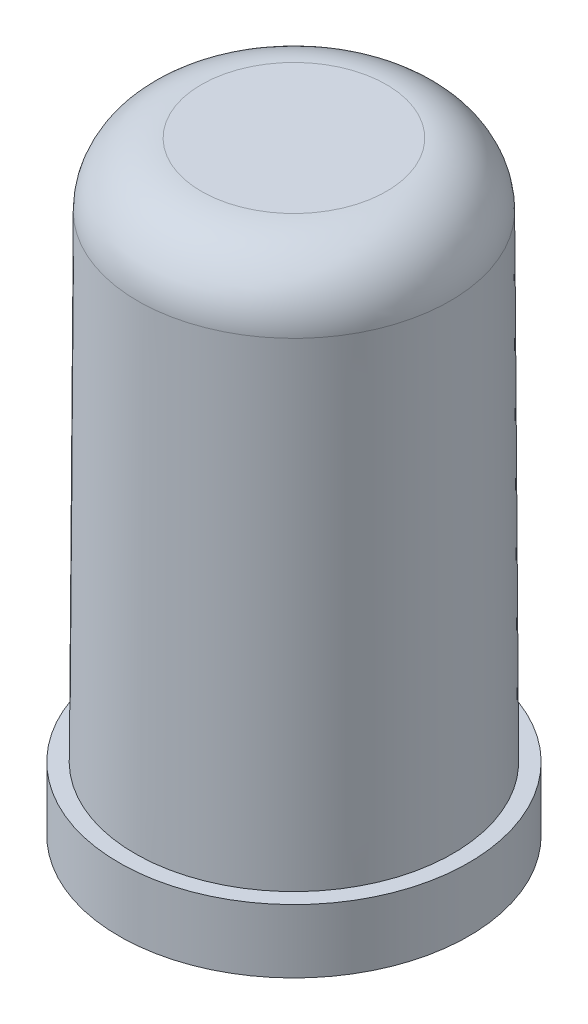
from build123d import *

# Parameters (mm, degrees)
FILLET_2_R = 2
FILLET_3_R = 2


with BuildPart() as part:
    # 草图1 → 旋转1 (revolve)
    with BuildSketch(Plane.XY):
        Polygon((0, 19), (0, 17), (-3.04, 17), (-3.04, 0), (-5.5, 0), (-5.5, 2), (-5, 2), (-4.9, 19), align=None)
    revolve(axis=Axis((0, 19, 0), (0, -1, 0)))

    # 圆角2
    fillet_2_edges = [part.edges().sort_by_distance(p)[0] for p in [
        (3.04, 17, 0),
    ]]
    fillet(fillet_2_edges, radius=FILLET_2_R)

    # 圆角3
    fillet_3_edges = [part.edges().sort_by_distance(p)[0] for p in [
        (4.9, 19, 0),
    ]]
    fillet(fillet_3_edges, radius=FILLET_3_R)


solid = part.part
